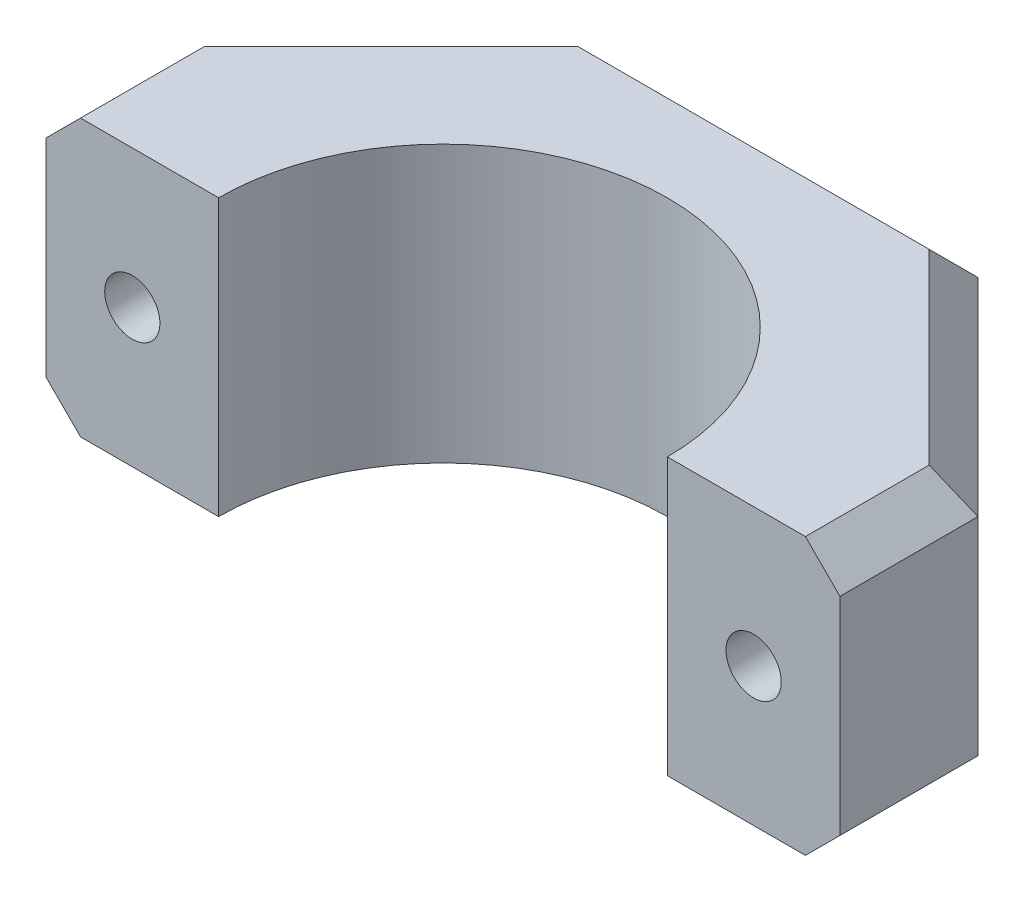
from build123d import *

# Parameters (mm, degrees)
BOSS_EXTRUDE1_DEPTH = 16
CHAMFER1_SIZE       = 12
SKETCH2_R           = 1.6
CUT_EXTRUDE1_DEPTH  = 20
SKETCH2_4_R         = 3
SKETCH2_4_R_2       = 1.6
CUT_EXTRUDE2_DEPTH  = 16
CHAMFER2_SIZE       = 2


with BuildPart() as part:
    # Sketch1 → Boss-Extrude1 (new body)
    with BuildSketch(Plane(origin=(0, 0, 0), x_dir=(1, 0, 0), z_dir=(0, 1, 0))):
        with BuildLine():
            Line((-34.485549133, -2.028901734), (-44.485549133, -2.028901734))
            Line((-44.485549133, -2.028901734), (-44.485549133, 17.971098266))
            Line((-44.485549133, 17.971098266), (1.514450867, 17.971098266))
            Line((1.514450867, 17.971098266), (1.514450867, -2.028901734))
            Line((1.514450867, -2.028901734), (-8.485549133, -2.028901734))
            ThreePointArc((-8.485549133, -2.028901734), (-21.485549133, 10.971098266), (-34.485549133, -2.028901734))
        make_face()
    extrude(amount=BOSS_EXTRUDE1_DEPTH)

    # Chamfer1
    chamfer1_edges = [part.edges().sort_by_distance(p)[0] for p in [
        (-44.485549133, 8, -17.971098266),
        (1.514450867, 8, -17.971098266),
    ]]
    chamfer(chamfer1_edges, length=CHAMFER1_SIZE)

    # Sketch2 → Cut-Extrude1 (cut)
    with BuildSketch(Plane(origin=(0, 0, -17.971098266), x_dir=(-1, 0, 0), z_dir=(0, 0, -1))):
        with Locations((39.485549133, 8)):
            Circle(SKETCH2_R)
        with Locations((3.485549133, 8)):
            Circle(SKETCH2_R)
    extrude(amount=-CUT_EXTRUDE1_DEPTH, mode=Mode.SUBTRACT)

    # Sketch2<4> → Cut-Extrude2 (cut)
    # profile 1 of 2: a face of its own
    with BuildSketch(Plane(origin=(0, 0, -17.971098266), x_dir=(-1, 0, 0), z_dir=(0, 0, -1))):
        with Locations((39.485549133, 8)):
            Circle(SKETCH2_4_R)
        with Locations((39.485549133, 8)):
            Circle(SKETCH2_4_R_2, mode=Mode.SUBTRACT)
    # profile 2 of 2: a face of its own
    with BuildSketch(Plane(origin=(0, 0, -17.971098266), x_dir=(-1, 0, 0), z_dir=(0, 0, -1))):
        with Locations((3.485549133, 8)):
            Circle(SKETCH2_4_R)
        with Locations((3.485549133, 8)):
            Circle(SKETCH2_4_R_2, mode=Mode.SUBTRACT)
    extrude(amount=-CUT_EXTRUDE2_DEPTH, mode=Mode.SUBTRACT)

    # Chamfer2
    chamfer2_edges = [part.edges().sort_by_distance(p)[0] for p in [
        (1.514450867, 16, -1.971098266),
        (-21.485549133, 0, -17.971098266),
        (-21.485549133, 16, -17.971098266),
        (-44.485549133, 0, -1.971098266),
        (-38.485549133, 0, -11.971098266),
        (-4.485549133, 0, -11.971098266),
        (-44.485549133, 16, -1.971098266),
        (-38.485549133, 16, -11.971098266),
        (-4.485549133, 16, -11.971098266),
        (1.514450867, 0, -1.971098266),
    ]]
    chamfer(chamfer2_edges, length=CHAMFER2_SIZE)


solid = part.part
